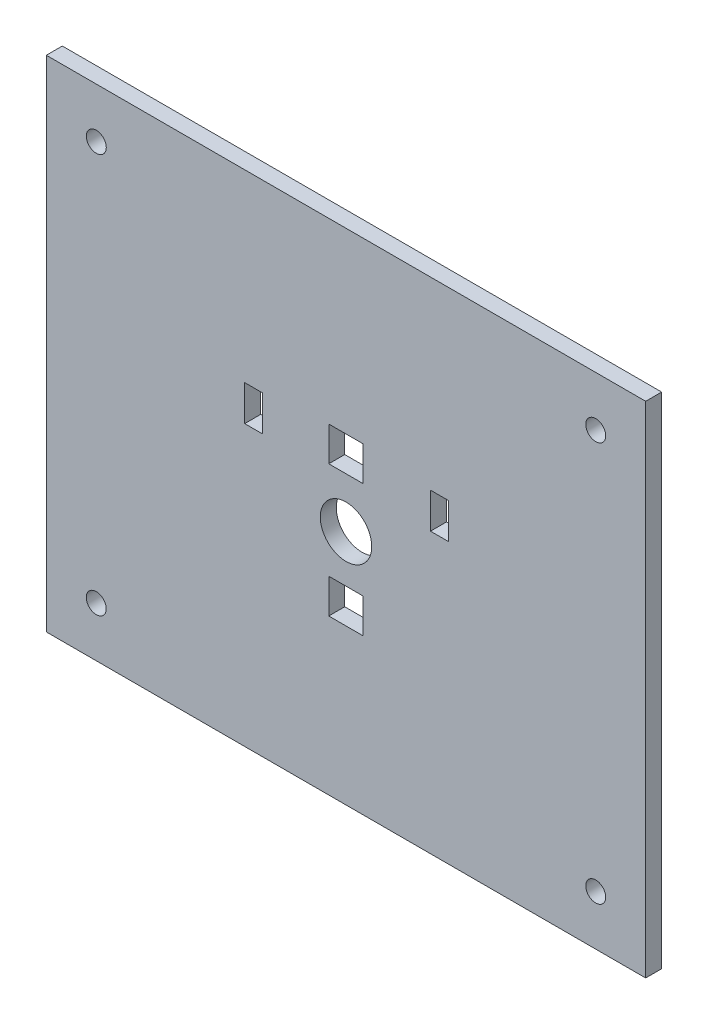
from build123d import *

# Parameters (mm, degrees)
MODEL_W             = 60
MODEL_H             = 50
MODEL_R             = 2.57574226
MODEL_R_2           = 1
MODEL_W_2           = 1.778
MODEL_H_2           = 3.556
MODEL_W_3           = 3.45000072
MODEL_H_3           = 3.45000072
BOSS_EXTRUDE1_DEPTH = 1.6


with BuildPart() as part:
    # Model → Boss-Extrude1 (new body)
    with BuildSketch(Plane.XY):
        with Locations((112.002348606, 75.004629004)):
            Rectangle(MODEL_W, MODEL_H)
        with Locations((112.002348606, 73.693071842)):
            Circle(MODEL_R, mode=Mode.SUBTRACT)
        with Locations((87.002348606, 95.004629004)):
            Circle(MODEL_R_2, mode=Mode.SUBTRACT)
        with Locations(Location((137.002348606, 95.004629004, 0), (0, 0, 180))):
            Circle(MODEL_R_2, mode=Mode.SUBTRACT)
        with Locations((137.002348606, 55.004629004)):
            Circle(MODEL_R_2, mode=Mode.SUBTRACT)
        with Locations(Location((87.002348606, 55.004629004, 0), (0, 0, 180))):
            Circle(MODEL_R_2, mode=Mode.SUBTRACT)
        with Locations((121.3499986, 79.75000052)):
            Rectangle(MODEL_W_2, MODEL_H_2, mode=Mode.SUBTRACT)
        with Locations((102.75000024, 79.7749992)):
            Rectangle(MODEL_W_2, MODEL_H_2, mode=Mode.SUBTRACT)
        with Locations((111.99999952, 80.44520106)):
            Rectangle(MODEL_W_3, MODEL_H_3, mode=Mode.SUBTRACT)
        with Locations((111.99999952, 67.25000012)):
            Rectangle(MODEL_W_3, MODEL_H_3, mode=Mode.SUBTRACT)
    extrude(amount=BOSS_EXTRUDE1_DEPTH)


solid = part.part
